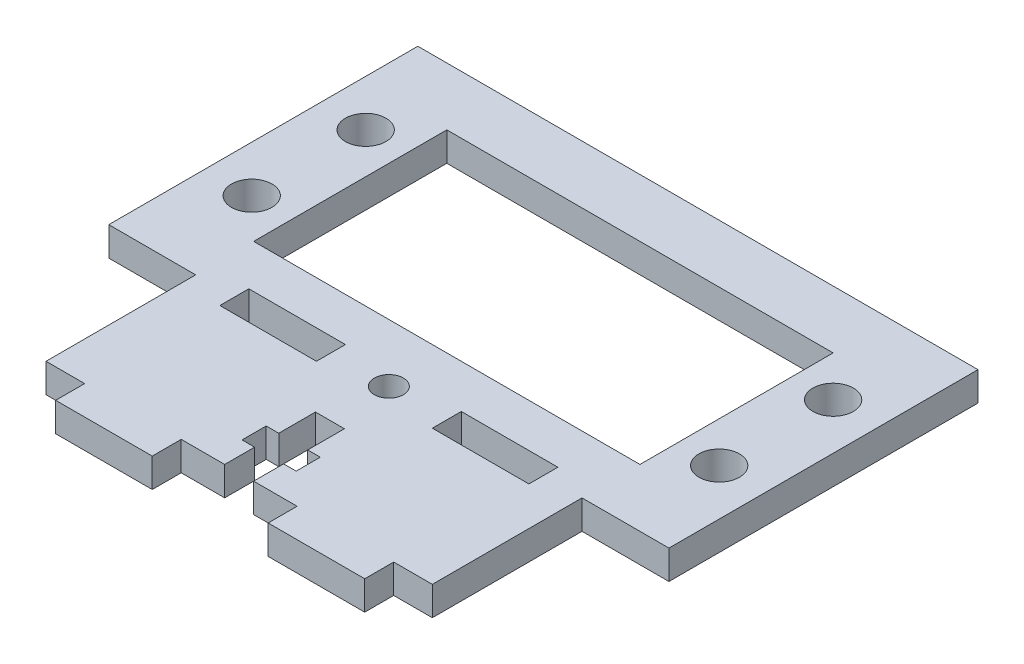
from build123d import *

# Parameters (mm, degrees)
SKETCH2_R           = 2.1
SKETCH2_R_2         = 1.5
SKETCH2_W           = 40
SKETCH2_H           = 20
SKETCH2_W_2         = 10
SKETCH2_H_2         = 3
BOSS_EXTRUDE1_DEPTH = 3


with BuildPart() as part:
    # Sketch2 → Boss-Extrude1 (new body)
    with BuildSketch(Plane(origin=(0, 0, 0), x_dir=(1, 0, 0), z_dir=(0, 1, 0))):
        Polygon((0, 15.5), (9, 15.5), (9, 47.5), (-49, 47.5), (-49, 15.5), (-40, 15.5), (-40, 0), (-36, 0), (-36, -3), (-26, -3), (-26, 0), (-21.5, 0), (-21.5, 3.1), (-22.8, 3.1), (-22.8, 5.6), (-21.5, 5.6), (-21.5, 9.4), (-18.5, 9.4), (-18.5, 5.6), (-17.2, 5.6), (-17.2, 3.1), (-18.5, 3.1), (-18.5, 0), (-14, 0), (-14, -3), (-4, -3), (-4, 0), (0, 0), align=None)
        with Locations(Location((4.2, 25.5, 0), (0, 0, 270))):
            Circle(SKETCH2_R, mode=Mode.SUBTRACT)
        with Locations(Location((4.2, 37.3, 0), (0, 0, 270))):
            Circle(SKETCH2_R, mode=Mode.SUBTRACT)
        with Locations(Location((-44.2, 37.3, 0), (0, 0, 270))):
            Circle(SKETCH2_R, mode=Mode.SUBTRACT)
        with Locations(Location((-44.2, 25.5, 0), (0, 0, 270))):
            Circle(SKETCH2_R, mode=Mode.SUBTRACT)
        with Locations(Location((-20, 15.5, 0), (0, 0, 270))):
            Circle(SKETCH2_R_2, mode=Mode.SUBTRACT)
        with Locations((-20, 31.5)):
            Rectangle(SKETCH2_W, SKETCH2_H, mode=Mode.SUBTRACT)
        with Locations((-31, 15.5)):
            Rectangle(SKETCH2_W_2, SKETCH2_H_2, mode=Mode.SUBTRACT)
        with Locations((-9, 15.5)):
            Rectangle(SKETCH2_W_2, SKETCH2_H_2, mode=Mode.SUBTRACT)
    extrude(amount=BOSS_EXTRUDE1_DEPTH)


solid = part.part
